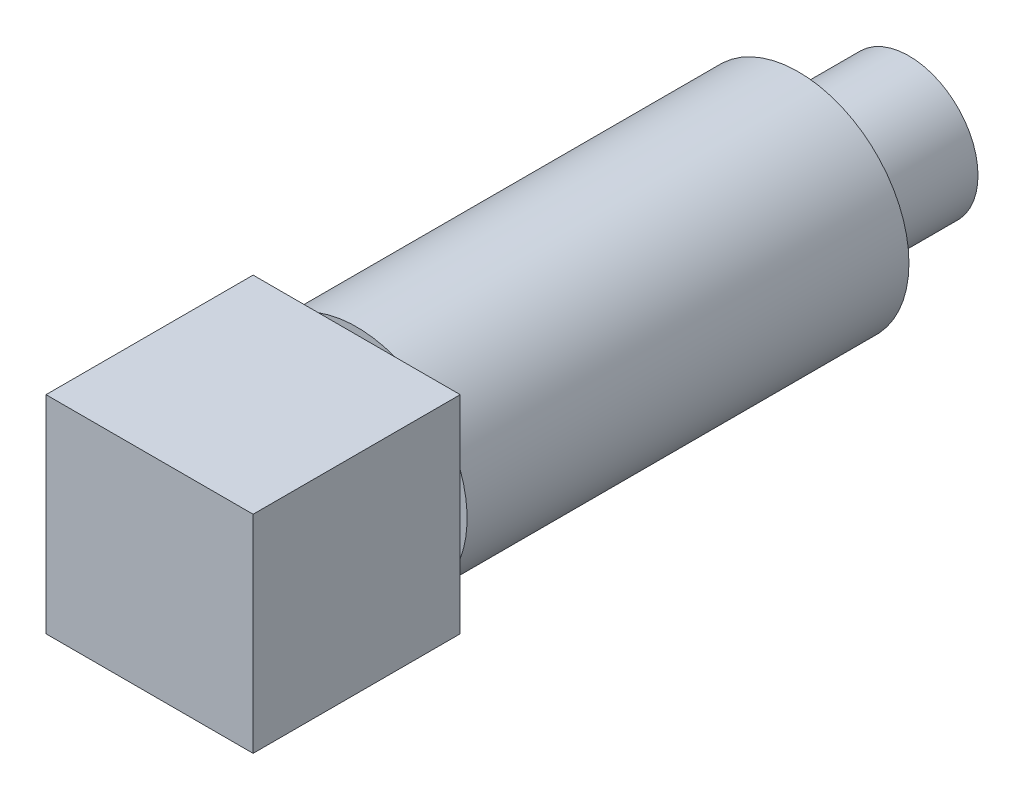
from build123d import *

# Parameters (mm, degrees)
SKETCH1_R           = 5
BOSS_EXTRUDE1_DEPTH = 8
SKETCH2_R           = 8
BOSS_EXTRUDE2_DEPTH = 32
SKETCH3_W           = 15
SKETCH3_H           = 15
BOSS_EXTRUDE3_DEPTH = 15


with BuildPart() as part:
    # Sketch1 → Boss-Extrude1 (new body)
    with BuildSketch(Plane.XY):
        Circle(SKETCH1_R)
    extrude(amount=BOSS_EXTRUDE1_DEPTH)

    # Sketch2 → Boss-Extrude2 (add)
    with BuildSketch(Plane.XY.offset(8)):
        Circle(SKETCH2_R)
    extrude(amount=BOSS_EXTRUDE2_DEPTH)

    # Sketch3 → Boss-Extrude3 (add)
    with BuildSketch(Plane.XY.offset(40)):
        Rectangle(SKETCH3_W, SKETCH3_H)
    extrude(amount=BOSS_EXTRUDE3_DEPTH)


solid = part.part
